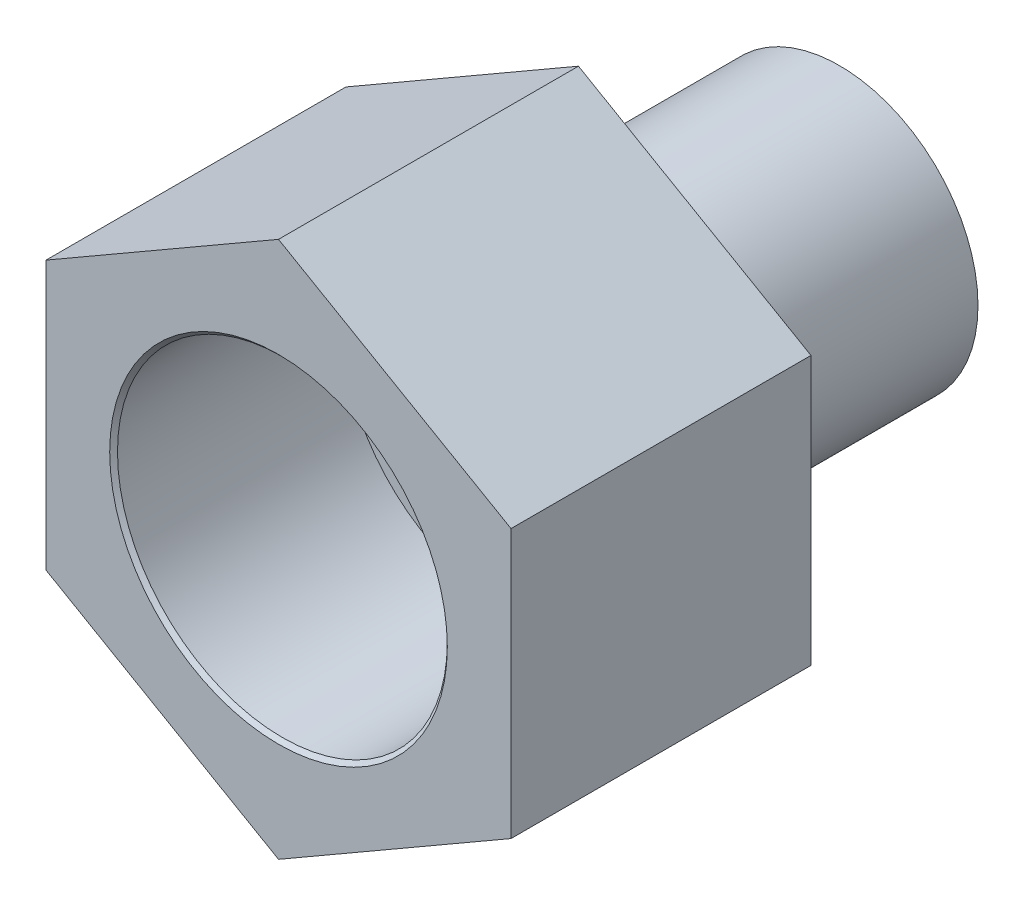
from build123d import *

# Parameters (mm, degrees)
SCHIZZO10_R                  = 20.675
ESTRUSIONE_ESTRUSIONE5_DEPTH = 43.2
TAGLIO_ESTRUSIONE11_DEPTH    = 23.1
FORO_25_5_25_4_1_D           = 25.4
FORO_25_5_25_4_1_DEPTH       = 17.6
FORO_25_5_25_4_1_CSINK_D     = 26
FORO_25_5_25_4_1_CSINK_ANGLE = 90
FORO_25_5_12_7_1_D           = 12.7
TAGLIO_ESTRUSIONE12_START    = -20.1
SCHIZZO24_R                  = 20.675
SCHIZZO24_R_2                = 10.668
TAGLIO_ESTRUSIONE12_DEPTH    = 20.1


with BuildPart() as part:
    # Schizzo10 → Estrusione-Estrusione5 (new body)
    with BuildSketch(Plane.XY):
        Circle(SCHIZZO10_R)
    extrude(amount=-ESTRUSIONE_ESTRUSIONE5_DEPTH)

    # Schizzo16 → Taglio-Estrusione11 (cut)
    with BuildSketch(Plane.XY):
        with BuildLine():
            Line((-17.905075223, 10.3375), (0, 20.675))
            ThreePointArc((0, 20.675), (-10.3375, 17.905075223), (-17.905075223, 10.3375))
        make_face()
        with BuildLine():
            ThreePointArc((17.905075223, 10.3375), (10.3375, 17.905075223), (0, 20.675))
            Line((0, 20.675), (17.905075223, 10.3375))
        make_face()
        with BuildLine():
            Line((-17.905075223, -10.3375), (-17.905075223, 10.3375))
            ThreePointArc((-17.905075223, 10.3375), (-20.675, 0), (-17.905075223, -10.3375))
        make_face()
        with BuildLine():
            Line((0, -20.675), (-17.905075223, -10.3375))
            ThreePointArc((-17.905075223, -10.3375), (-10.3375, -17.905075223), (0, -20.675))
        make_face()
        with BuildLine():
            ThreePointArc((0, -20.675), (10.3375, -17.905075223), (17.905075223, -10.3375))
            Line((17.905075223, -10.3375), (0, -20.675))
        make_face()
        with BuildLine():
            ThreePointArc((20.675, 0), (19.970516459, 5.351083757), (17.905075223, 10.3375))
            Line((17.905075223, 10.3375), (17.905075223, -10.3375))
            ThreePointArc((17.905075223, -10.3375), (19.970516459, -5.351083757), (20.675, 0))
        make_face()
    extrude(amount=-TAGLIO_ESTRUSIONE11_DEPTH, mode=Mode.SUBTRACT)

    # Foro Ø25.5 (25.4)-1
    with Locations(Plane.XY):
        with Locations((0, 0)):
            CounterSinkHole(FORO_25_5_25_4_1_D / 2, FORO_25_5_25_4_1_CSINK_D / 2, depth=FORO_25_5_25_4_1_DEPTH, counter_sink_angle=FORO_25_5_25_4_1_CSINK_ANGLE)

    # Foro Ø25.5 (12.7)-1 (through all)
    with Locations(Plane.XY.offset(-17.6)):
        with Locations((0, 0)):
            Hole(FORO_25_5_12_7_1_D / 2)

    # Schizzo24 → Taglio-Estrusione12 (cut)
    with BuildSketch(Plane(origin=(0, 0, -43.2), x_dir=(-1, 0, 0), z_dir=(0, 0, -1)).offset(TAGLIO_ESTRUSIONE12_START)):
        Circle(SCHIZZO24_R)
        Circle(SCHIZZO24_R_2, mode=Mode.SUBTRACT)
    extrude(amount=TAGLIO_ESTRUSIONE12_DEPTH, mode=Mode.SUBTRACT)


solid = part.part
